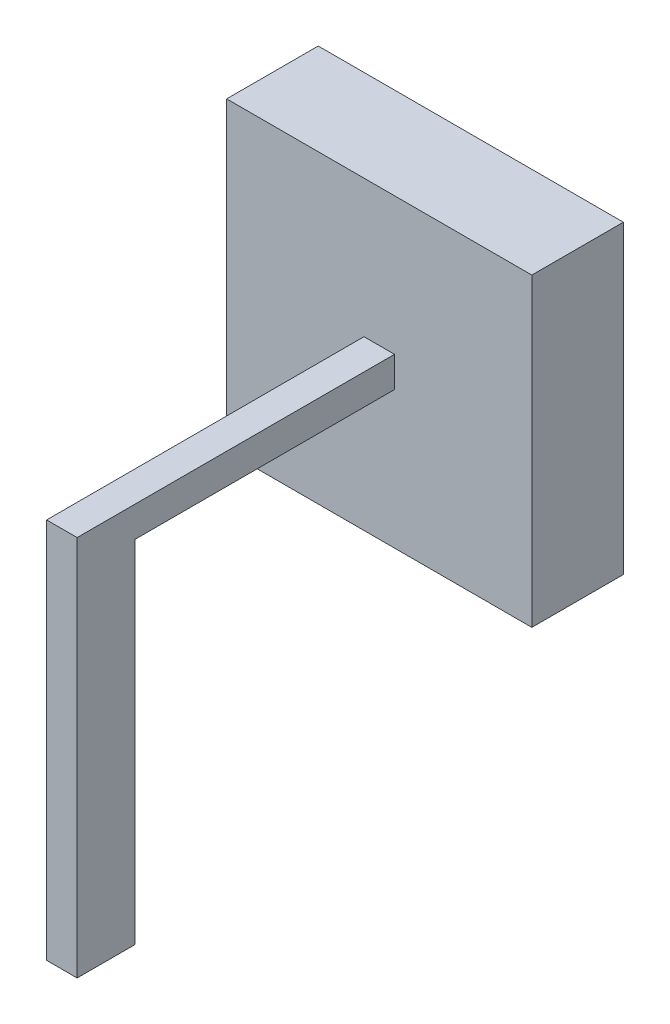
from build123d import *

# Parameters (mm, degrees)
SKETCH1_W           = 10
SKETCH1_H           = 10
BOSS_EXTRUDE3_DEPTH = 3
SKETCH5_W           = 1
SKETCH5_H           = 1
BOSS_EXTRUDE4_DEPTH = 10.4
SKETCH6_W           = 1
SKETCH6_H           = 1.9
BOSS_EXTRUDE5_DEPTH = 12.5


with BuildPart() as part:
    # Sketch1 → Boss-Extrude3 (new body)
    with BuildSketch(Plane.XY):
        Rectangle(SKETCH1_W, SKETCH1_H)
    extrude(amount=-BOSS_EXTRUDE3_DEPTH)

    # Sketch5 → Boss-Extrude4 (add)
    with BuildSketch(Plane.XY):
        Rectangle(SKETCH5_W, SKETCH5_H)
    extrude(amount=BOSS_EXTRUDE4_DEPTH)

    # Sketch6 → Boss-Extrude5 (add)
    with BuildSketch(Plane(origin=(0, 0.5, 0), x_dir=(1, 0, 0), z_dir=(0, 1, 0))):
        with Locations((0, -9.45)):
            Rectangle(SKETCH6_W, SKETCH6_H)
    extrude(amount=-BOSS_EXTRUDE5_DEPTH)


solid = part.part
